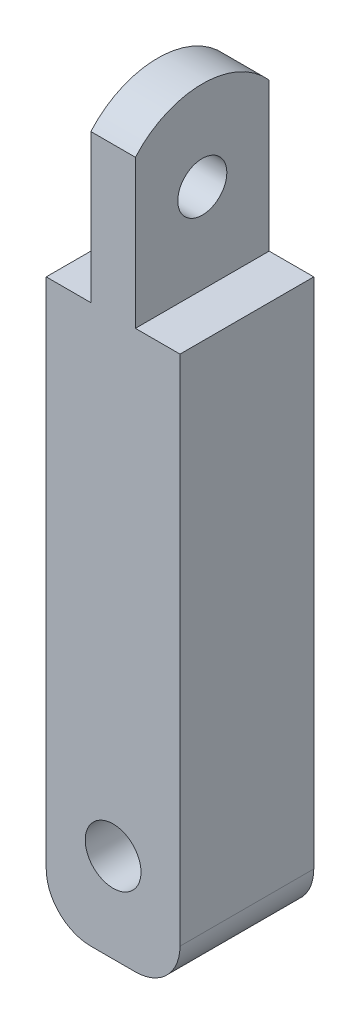
from build123d import *

# Parameters (mm, degrees)
BOSS_EXTRUDE1_DEPTH = 6
SKETCH2_R           = 1.25
CUT_EXTRUDE1_DEPTH  = 22.56965461
CUT_EXTRUDE2_DEPTH  = 2.5
SKETCH4_R           = 1.1
CUT_EXTRUDE3_DEPTH  = 22.731313812
CUT_EXTRUDE4_DEPTH  = 22.731313812
FILLET1_R           = 2


with BuildPart() as part:
    # Sketch1 → Boss-Extrude1 (new body)
    with BuildSketch(Plane.XY):
        Polygon((-1, 12.5), (-1, 20.5), (1, 20.5), (1, 12.5), (3, 12.5), (3, -12.5), (-3, -12.5), (-3, 12.5), align=None)
    extrude(amount=BOSS_EXTRUDE1_DEPTH)

    # Sketch2 → Cut-Extrude1 (cut, through all)
    with BuildSketch(Plane.XY.offset(6)):
        with Locations((0, -8.5)):
            Circle(SKETCH2_R)
    extrude(amount=-CUT_EXTRUDE1_DEPTH, mode=Mode.SUBTRACT)

    # Sketch3 → Cut-Extrude2 (cut)
    with BuildSketch(Plane(origin=(0, 0, 0), x_dir=(-1, 0, 0), z_dir=(0, 0, -1))):
        Polygon((0, -6.075128869), (-2.1, -7.287564435), (-2.1, -9.712435565), (0, -10.924871131), (2.1, -9.712435565), (2.1, -7.287564435), align=None)
    extrude(amount=-CUT_EXTRUDE2_DEPTH, mode=Mode.SUBTRACT)

    # Sketch4 → Cut-Extrude3 (cut, through all)
    with BuildSketch(Plane.ZY.offset(1)):
        with Locations(Location((3, 16.5, 0), (0, 0, 270))):
            Circle(SKETCH4_R)
    extrude(amount=-CUT_EXTRUDE3_DEPTH, mode=Mode.SUBTRACT)

    # Sketch5 → Cut-Extrude4 (cut, through all)
    with BuildSketch(Plane.ZY.offset(1)):
        with BuildLine():
            Line((6, 20.5), (3, 20.5))
            ThreePointArc((3, 20.5), (4.645751311, 20.145751311), (6, 19.145751311))
            Line((6, 19.145751311), (6, 20.5))
        make_face()
        with BuildLine():
            Line((0, 20.5), (0, 19.145751311))
            ThreePointArc((0, 19.145751311), (1.354248689, 20.145751311), (3, 20.5))
            Line((3, 20.5), (0, 20.5))
        make_face()
    extrude(amount=-CUT_EXTRUDE4_DEPTH, mode=Mode.SUBTRACT)

    # Fillet1
    fillet1_edges = [part.edges().sort_by_distance(p)[0] for p in [
        (3, -12.5, 3),
        (-3, -12.5, 3),
    ]]
    fillet(fillet1_edges, radius=FILLET1_R)


solid = part.part
